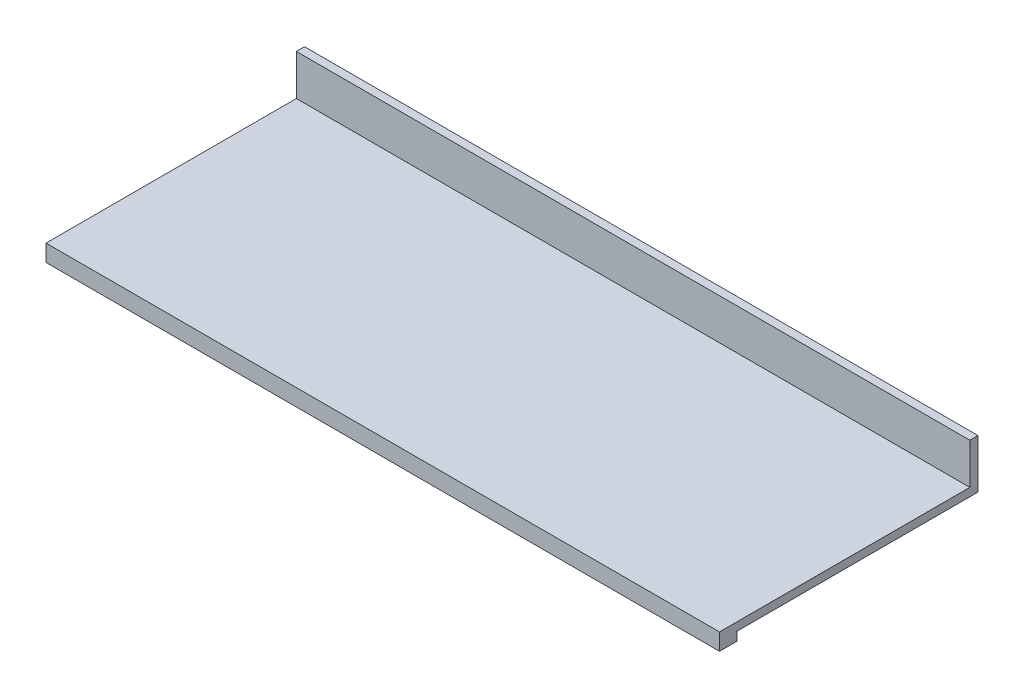
from build123d import *

# Parameters (mm, degrees)
SKETCH1_W           = 990
SKETCH1_H           = 380
BOSS_EXTRUDE1_DEPTH = 12
SKETCH2_W           = 990
SKETCH2_H           = 25.4
BOSS_EXTRUDE2_DEPTH = 12.7
SKETCH3_W           = 990
SKETCH3_H           = 12
BOSS_EXTRUDE3_DEPTH = 60


with BuildPart() as part:
    # Sketch1 → Boss-Extrude1 (new body)
    with BuildSketch(Plane(origin=(0, 0, 0), x_dir=(1, 0, 0), z_dir=(0, 1, 0))):
        Rectangle(SKETCH1_W, SKETCH1_H)
    extrude(amount=BOSS_EXTRUDE1_DEPTH)

    # Sketch2 → Boss-Extrude2 (add)
    with BuildSketch(Plane.XZ):
        with Locations((0, 177.3)):
            Rectangle(SKETCH2_W, SKETCH2_H)
    extrude(amount=BOSS_EXTRUDE2_DEPTH)

    # Sketch3 → Boss-Extrude3 (add)
    with BuildSketch(Plane(origin=(0, 12, 0), x_dir=(1, 0, 0), z_dir=(0, 1, 0))):
        with Locations((0, 184)):
            Rectangle(SKETCH3_W, SKETCH3_H)
    extrude(amount=BOSS_EXTRUDE3_DEPTH)


solid = part.part
